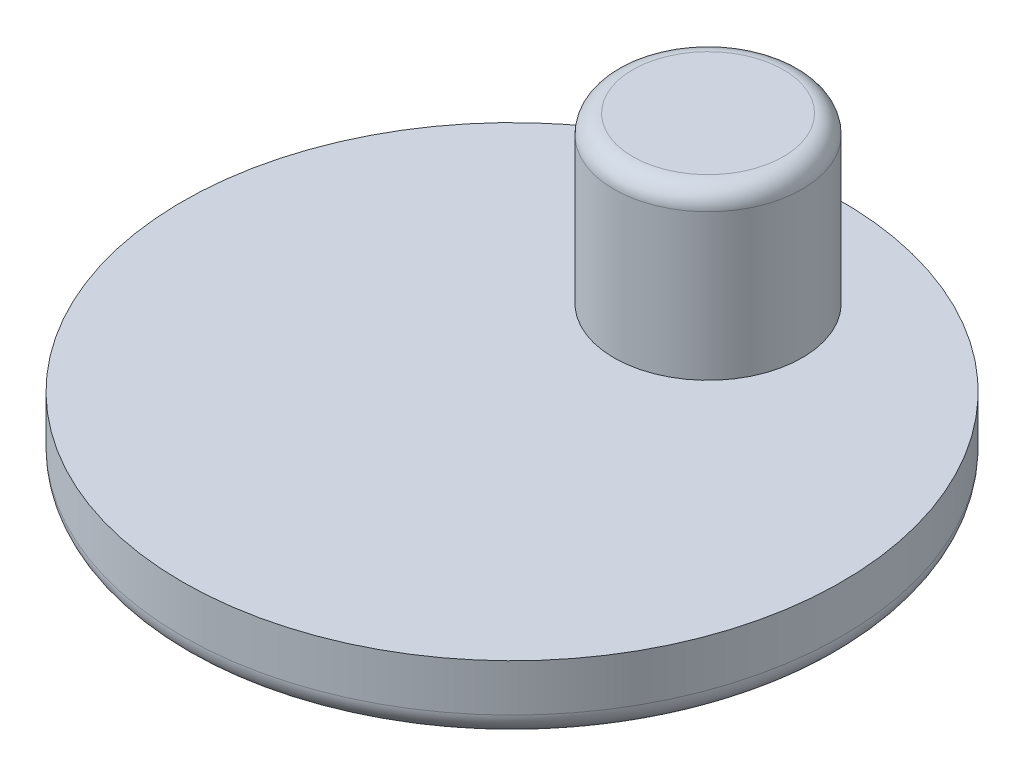
from build123d import *

# Parameters (mm, degrees)
SKETCH1_R           = 7
BOSS_EXTRUDE1_DEPTH = 1.5
SKETCH2_R           = 2
BOSS_EXTRUDE2_DEPTH = 3.5
FILLET1_R           = 0.4
FILLET2_R           = 0.5


with BuildPart() as part:
    # Sketch1 → Boss-Extrude1 (new body)
    with BuildSketch(Plane(origin=(0, 0, 0), x_dir=(1, 0, 0), z_dir=(0, 1, 0))):
        with Locations(Location((0, 0, 0), (0, 0, 270))):
            Circle(SKETCH1_R)
    extrude(amount=BOSS_EXTRUDE1_DEPTH)

    # Sketch2 → Boss-Extrude2 (add)
    with BuildSketch(Plane(origin=(0, 1.5, -3.633475181), x_dir=(1, 0, 0), z_dir=(0, 1, 0))):
        with Locations(Location((0.458499022, 0.070739169, 0), (0, 0, 270))):
            Circle(SKETCH2_R)
    extrude(amount=BOSS_EXTRUDE2_DEPTH)

    # Fillet1
    fillet1_edges = [part.edges().sort_by_distance(p)[0] for p in [
        (0.458499022, 5, -5.70421435),
    ]]
    fillet(fillet1_edges, radius=FILLET1_R)

    # Fillet2
    fillet2_edges = [part.edges().sort_by_distance(p)[0] for p in [
        (0, 0, -7),
    ]]
    fillet(fillet2_edges, radius=FILLET2_R)


solid = part.part
